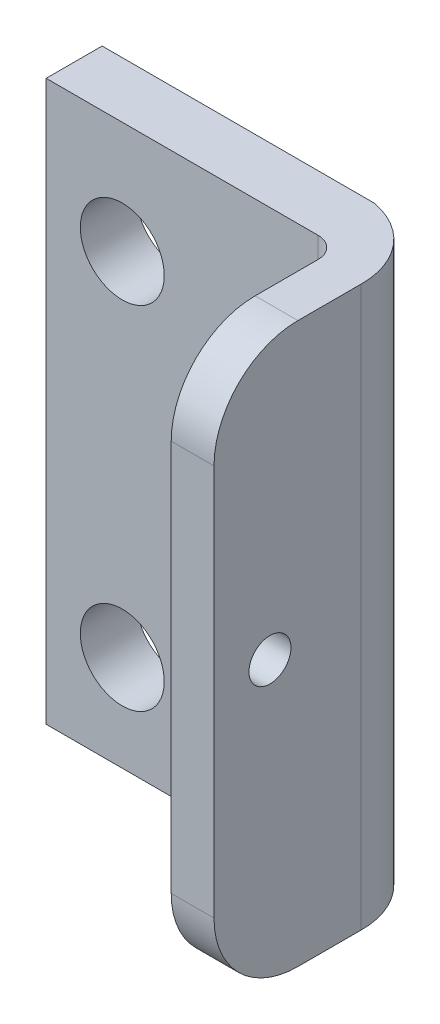
from build123d import *

# Parameters (mm, degrees)
SKETCH1_R           = 1.5
BOSS_EXTRUDE1_DEPTH = 2
BOSS_EXTRUDE2_DEPTH = 20
SKETCH3_R           = 0.75
BOSS_EXTRUDE3_DEPTH = 1.53


with BuildPart() as part:
    # Sketch1 → Boss-Extrude1 (new body)
    with BuildSketch(Plane.XY):
        Polygon((0, 0), (9.72, 0), (9.72, 10), (9.72, 20), (0, 20), align=None)
        with Locations((2.72, 16)):
            Circle(SKETCH1_R, mode=Mode.SUBTRACT)
        with Locations((2.72, 3.43)):
            Circle(SKETCH1_R, mode=Mode.SUBTRACT)
    extrude(amount=BOSS_EXTRUDE1_DEPTH)

    # Sketch2 → Boss-Extrude2 (add)
    with BuildSketch(Plane.XZ):
        with BuildLine():
            Line((9.72, 2), (9.72, 0))
            ThreePointArc((9.72, 0), (11.367131495, 0.954473399), (11.999702326, 2.75))
            Line((11.999702326, 2.75), (10.47, 2.75))
            ThreePointArc((10.47, 2.75), (10.250330086, 2.219669914), (9.72, 2))
        make_face()
    extrude(amount=-BOSS_EXTRUDE2_DEPTH)

    # Sketch3 → Boss-Extrude3 (add)
    with BuildSketch(Plane(origin=(12, 0, 0), x_dir=(0, 0, -1), z_dir=(1, 0, 0))):
        with BuildLine():
            Line((-2.75, 20), (-5, 20))
            ThreePointArc((-5, 20), (-7.121320344, 19.121320344), (-8, 17))
            Line((-8, 17), (-8, 3))
            ThreePointArc((-8, 3), (-7.121320344, 0.878679656), (-5, 0))
            Line((-5, 0), (-2.75, 0))
            Line((-2.75, 0), (-2.75, 20))
        make_face()
        with Locations((-6, 10)):
            Circle(SKETCH3_R, mode=Mode.SUBTRACT)
    extrude(amount=-BOSS_EXTRUDE3_DEPTH)


solid = part.part
